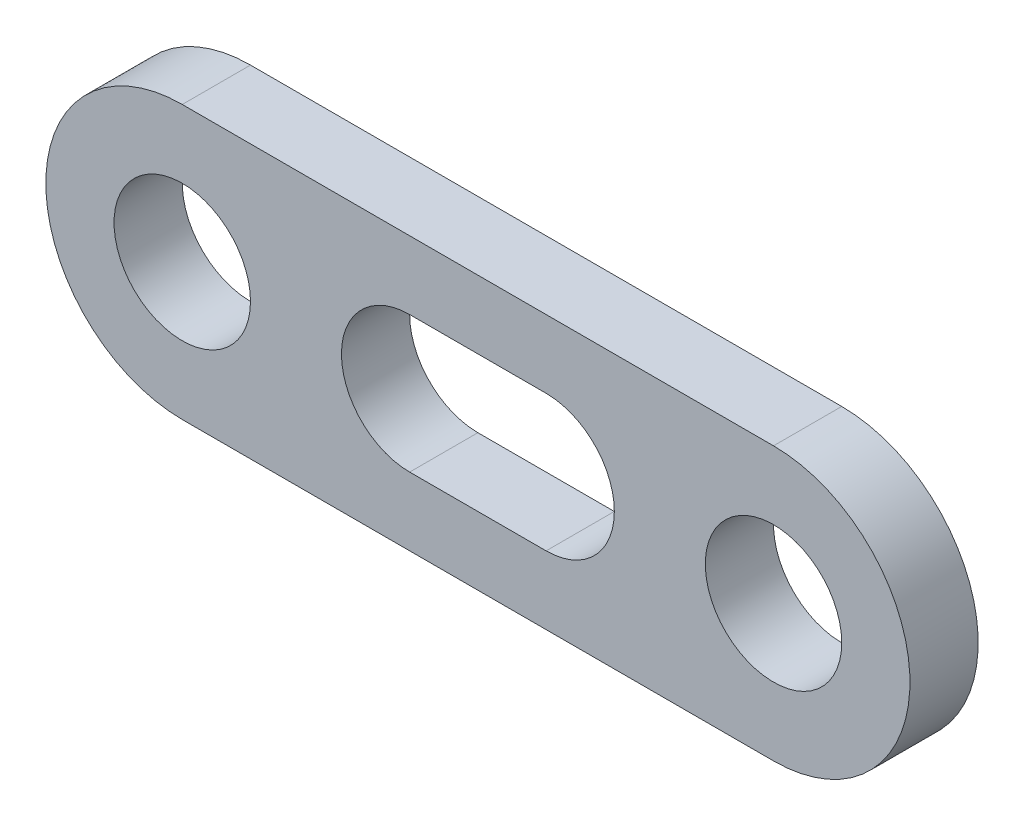
from build123d import *

# Parameters (mm, degrees)
SKETCH_2_R      = 3
EXTRUDE_1_DEPTH = 3


with BuildPart() as part:
    # 草图2 → 凸台-拉伸1 (new body)
    with BuildSketch(Plane.XY):
        with BuildLine():
            Line((0, 6), (26, 6))
            ThreePointArc((26, 6), (32, 0), (26, -6))
            Line((26, -6), (0, -6))
            ThreePointArc((0, -6), (-6, 0), (0, 6))
        make_face()
        Circle(SKETCH_2_R, mode=Mode.SUBTRACT)
        with Locations((26, 0)):
            Circle(SKETCH_2_R, mode=Mode.SUBTRACT)
        with BuildLine():
            Line((10, 3), (16, 3))
            ThreePointArc((16, 3), (19, 0), (16, -3))
            Line((16, -3), (10, -3))
            ThreePointArc((10, -3), (7, 0), (10, 3))
        make_face(mode=Mode.SUBTRACT)
    extrude(amount=EXTRUDE_1_DEPTH)


solid = part.part
